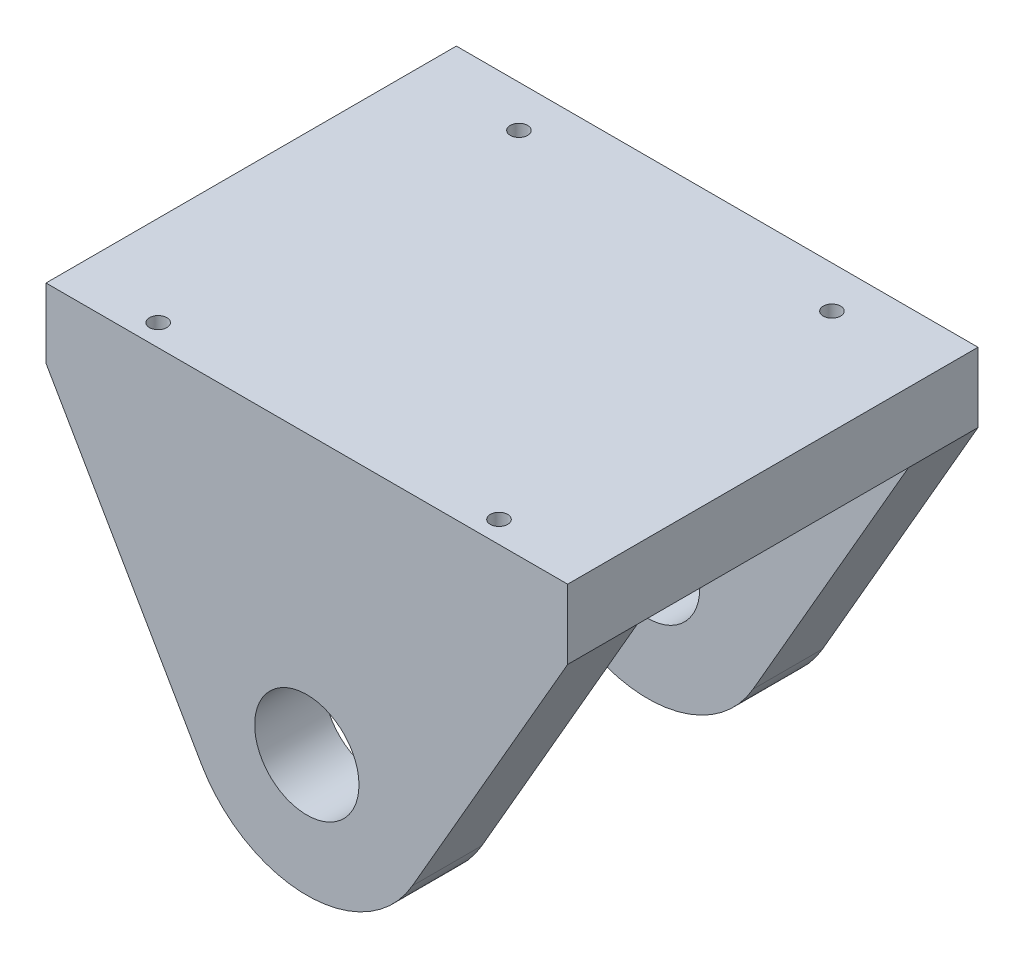
from build123d import *

# Parameters (mm, degrees)
SKETCH1_R                       = 7.5
BOSS_EXTRUDE1_DEPTH             = 10
SKETCH1_3_W                     = 75
SKETCH1_3_H                     = 10
BOSS_EXTRUDE2_DEPTH             = 59
TAP_DRILL_FOR_M3X0_5_TAP1_D     = 2.5
TAP_DRILL_FOR_M3X0_5_TAP1_DEPTH = 8
TAP_DRILL_FOR_M3X0_5_TAP1_TIP   = 0.751075774


with BuildPart() as part:
    # Sketch1 → Boss-Extrude1 (new body)
    with BuildSketch(Plane.XY):
        with BuildLine():
            Line((37.5, 30), (-37.5, 30))
            Line((-37.5, 30), (-15.160146889, -8.741850278))
            ThreePointArc((-15.160146889, -8.741850278), (0, -17.5), (15.160146889, -8.741850278))
            Line((15.160146889, -8.741850278), (37.5, 30))
        make_face()
        Circle(SKETCH1_R, mode=Mode.SUBTRACT)
    boss_extrude1 = extrude(amount=-BOSS_EXTRUDE1_DEPTH)

    # Sketch1<3> → Boss-Extrude2 (add)
    with BuildSketch(Plane.XY):
        with Locations((0, 35)):
            Rectangle(SKETCH1_3_W, SKETCH1_3_H)
    extrude(amount=-BOSS_EXTRUDE2_DEPTH)

    # Mirror2: Boss-Extrude1 across plane
    add(boss_extrude1.mirror(Plane.XY.offset(-29.5)))

    # Tap Drill for M3x0.5 Tap1
    with Locations(Plane(origin=(0, 40, 0), x_dir=(1, 0, 0), z_dir=(0, 1, 0))):
        with Locations((-22.5, 53), (22.5, 53), (-24.5, 3.13), (24.5, 3.13)):
            Hole(TAP_DRILL_FOR_M3X0_5_TAP1_D / 2, depth=TAP_DRILL_FOR_M3X0_5_TAP1_DEPTH)
            with Locations((0, 0, -(TAP_DRILL_FOR_M3X0_5_TAP1_DEPTH + TAP_DRILL_FOR_M3X0_5_TAP1_TIP / 2))):  # 118° drill point
                Cone(0, TAP_DRILL_FOR_M3X0_5_TAP1_D / 2, TAP_DRILL_FOR_M3X0_5_TAP1_TIP, mode=Mode.SUBTRACT)


solid = part.part
